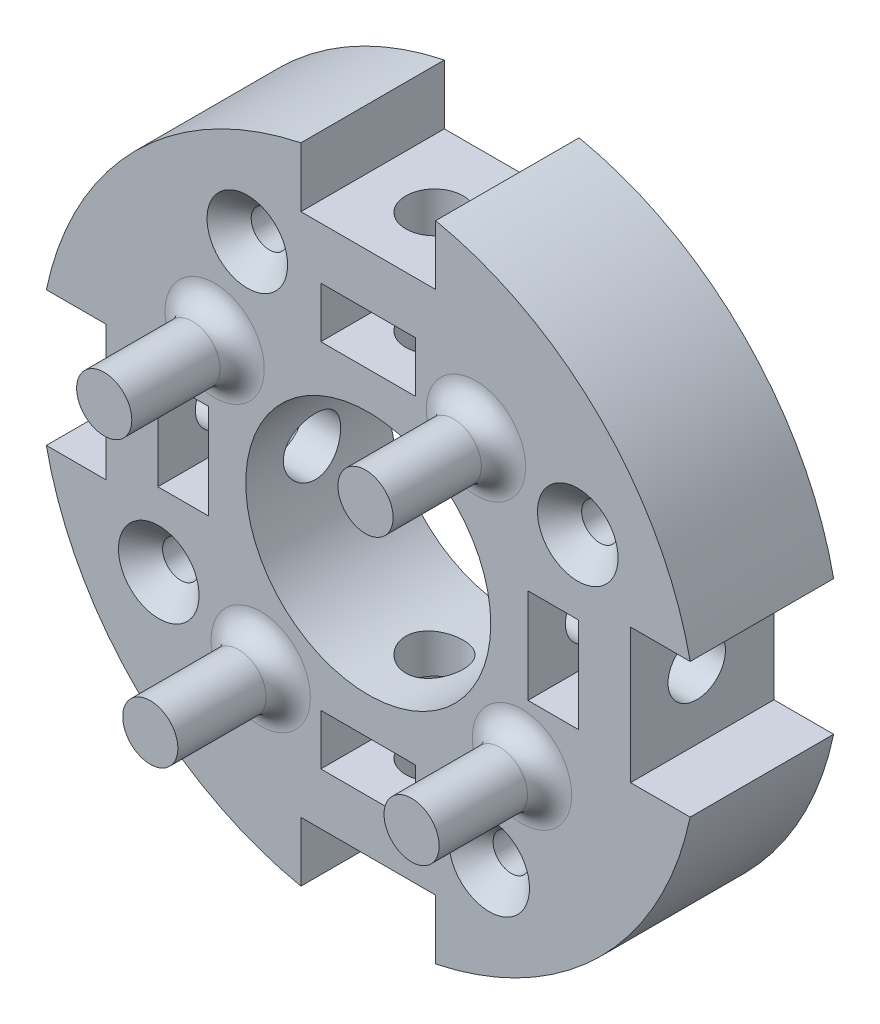
from build123d import *

# Parameters (mm, degrees)
ESQUISSE1_R                  = 11.1
ESQUISSE1_R_2                = 1.65
ESQUISSE1_W                  = 8.6
ESQUISSE1_H                  = 4.6
ESQUISSE1_W_2                = 4.6
ESQUISSE1_H_2                = 8.6
BOSS_EXTRU_1_DEPTH           = 13
CHANFREIN1_SIZE              = 2
ESQUISSE6_R                  = 2.6
ENL_V_MAT_EXTRU_4_DEPTH      = 17
R_P_TITION_CIRCULAIRE1_COUNT = 4
ESQUISSE7_R                  = 2.5
BOSS_EXTRU_2_DEPTH           = 10
CONG_1_R                     = 2


with BuildPart() as part:
    # Esquisse1 → Boss.-Extru.1 (new body)
    with BuildSketch(Plane.XY):
        with BuildLine():
            Line((-6.105930323, 29.167749568), (-6.105930323, 23.762922109))
            Line((-6.105930323, 23.762922109), (6.105930323, 23.762922109))
            Line((6.105930323, 23.762922109), (6.105930323, 29.167749568))
            ThreePointArc((6.105930323, 29.167749568), (21.071782079, 21.071782079), (29.167749568, 6.105930323))
            Line((29.167749568, 6.105930323), (23.762922109, 6.105930323))
            Line((23.762922109, 6.105930323), (23.762922109, -6.105930323))
            Line((23.762922109, -6.105930323), (29.167749568, -6.105930323))
            ThreePointArc((29.167749568, -6.105930323), (21.071782079, -21.071782079), (6.105930323, -29.167749568))
            Line((6.105930323, -29.167749568), (6.105930323, -23.762922109))
            Line((6.105930323, -23.762922109), (-6.105930323, -23.762922109))
            Line((-6.105930323, -23.762922109), (-6.105930323, -29.167749568))
            ThreePointArc((-6.105930323, -29.167749568), (-21.071782079, -21.071782079), (-29.167749568, -6.105930323))
            Line((-29.167749568, -6.105930323), (-23.762922109, -6.105930323))
            Line((-23.762922109, -6.105930323), (-23.762922109, 6.105930323))
            Line((-23.762922109, 6.105930323), (-29.167749568, 6.105930323))
            ThreePointArc((-29.167749568, 6.105930323), (-21.071782079, 21.071782079), (-6.105930323, 29.167749568))
        make_face()
        with Locations(Location((0, 0, 0), (0, 0, 180))):
            Circle(ESQUISSE1_R, mode=Mode.SUBTRACT)
        with Locations(Location((-10.960155108, 18.983545507, 0), (0, 0, 180))):
            Circle(ESQUISSE1_R_2, mode=Mode.SUBTRACT)
        with Locations(Location((18.983545507, 10.960155108, 0), (0, 0, 180))):
            Circle(ESQUISSE1_R_2, mode=Mode.SUBTRACT)
        with Locations(Location((10.960155108, -18.983545507, 0), (0, 0, 180))):
            Circle(ESQUISSE1_R_2, mode=Mode.SUBTRACT)
        with Locations(Location((-18.983545507, -10.960155108, 0), (0, 0, 180))):
            Circle(ESQUISSE1_R_2, mode=Mode.SUBTRACT)
        with Locations((0, 16.762922109)):
            Rectangle(ESQUISSE1_W, ESQUISSE1_H, mode=Mode.SUBTRACT)
        with Locations((16.762922109, 0)):
            Rectangle(ESQUISSE1_W_2, ESQUISSE1_H_2, mode=Mode.SUBTRACT)
        with Locations((0, -16.762922109)):
            Rectangle(ESQUISSE1_W, ESQUISSE1_H, mode=Mode.SUBTRACT)
        with Locations((-16.762922109, 0)):
            Rectangle(ESQUISSE1_W_2, ESQUISSE1_H_2, mode=Mode.SUBTRACT)
    extrude(amount=BOSS_EXTRU_1_DEPTH)

    # Chanfrein1
    chanfrein1_edges = [part.edges().sort_by_distance(p)[0] for p in [
        (-9.310155108, 18.983545507, 13),
        (20.633545507, 10.960155108, 13),
        (12.610155108, -18.983545507, 13),
        (-17.333545507, -10.960155108, 13),
    ]]
    chamfer(chanfrein1_edges, length=CHANFREIN1_SIZE)

    # Esquisse6 → Enlèv. mat.-Extru.4 (cut)
    with BuildSketch(Plane.ZY.offset(23.762922109)):
        with Locations((7, 0)):
            Circle(ESQUISSE6_R)
    enl_v_mat_extru_4 = extrude(amount=-ENL_V_MAT_EXTRU_4_DEPTH, mode=Mode.SUBTRACT)

    # Répétition circulaire1: Enlèv. mat.-Extru.4 ×4 about axis
    r_p_tition_circulaire1_axis = Axis((0, 0, 0), (0, 0, -1))
    for i in range(1, R_P_TITION_CIRCULAIRE1_COUNT):
        add(enl_v_mat_extru_4.rotate(r_p_tition_circulaire1_axis, i * 360 / R_P_TITION_CIRCULAIRE1_COUNT), mode=Mode.SUBTRACT)

    # Esquisse7 → Boss.-Extru.2 (add)
    with BuildSketch(Plane.XY.offset(13)):
        with Locations((-13.925584753, 9.750799418)):
            Circle(ESQUISSE7_R)
        with Locations((9.750799418, 13.925584753)):
            Circle(ESQUISSE7_R)
        with Locations((13.925584753, -9.750799418)):
            Circle(ESQUISSE7_R)
        with Locations((-9.750799418, -13.925584753)):
            Circle(ESQUISSE7_R)
    extrude(amount=BOSS_EXTRU_2_DEPTH)

    # Congé1
    cong_1_edges = [part.edges().sort_by_distance(p)[0] for p in [
        (-16.425584753, 9.750799418, 13),
        (7.250799418, 13.925584753, 13),
        (11.425584753, -9.750799418, 13),
        (-12.250799418, -13.925584753, 13),
    ]]
    fillet(cong_1_edges, radius=CONG_1_R)


solid = part.part
